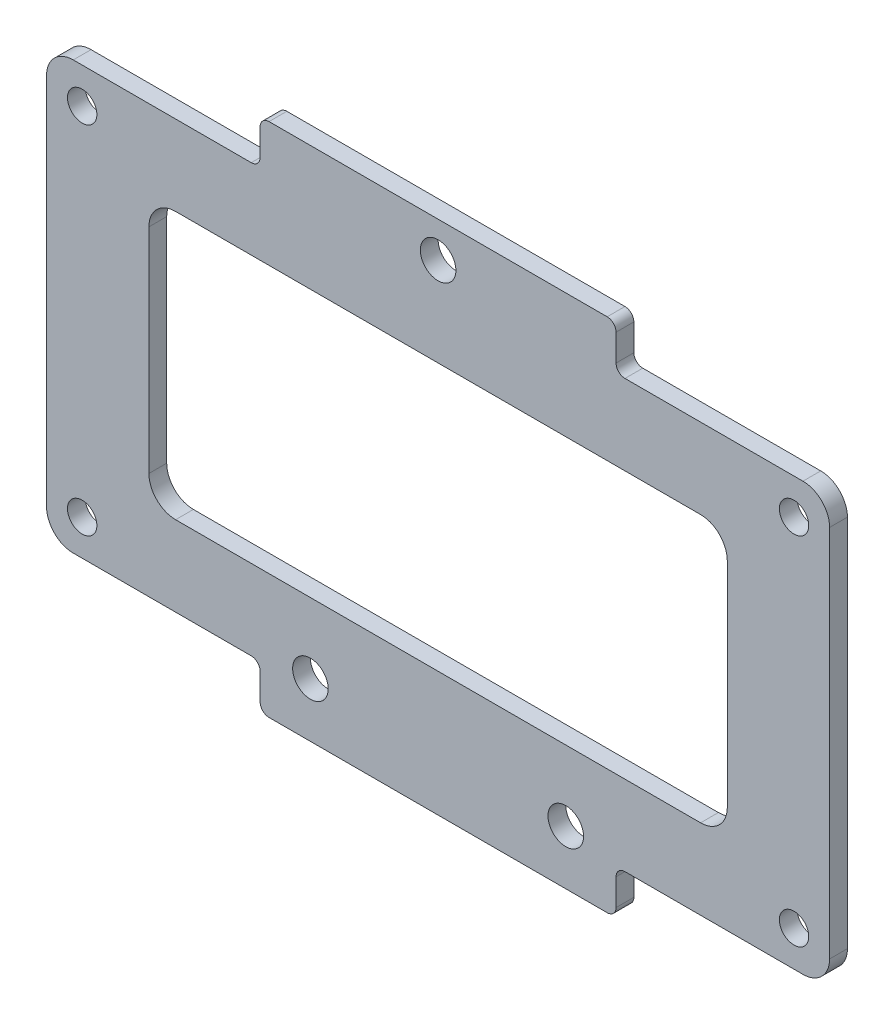
from build123d import *

# Parameters (mm, degrees)
SKETCH_1_W          = 88
SKETCH_1_H          = 48
SKETCH_1_R          = 1.65
EXTRUDE_1_DEPTH     = 2
FILLET_1_R          = 3
SKETCH_3_W          = 40
SKETCH_3_H          = 10
EXTRUDE_2_DEPTH     = 2
SKETCH_2_R          = 2
CUT_EXTRUDE_1_DEPTH = 2
SKETCH_4_W          = 65
SKETCH_4_H          = 30
CUT_EXTRUDE_2_DEPTH = 2
FILLET_2_R          = 3
FILLET_3_R          = 1


with BuildPart() as part:
    # 草图1 → 凸台-拉伸1 (new body)
    with BuildSketch(Plane.XY):
        Rectangle(SKETCH_1_W, SKETCH_1_H)
        with Locations((-40, 20)):
            Circle(SKETCH_1_R, mode=Mode.SUBTRACT)
        with Locations((40, 20)):
            Circle(SKETCH_1_R, mode=Mode.SUBTRACT)
        with Locations((40, -20)):
            Circle(SKETCH_1_R, mode=Mode.SUBTRACT)
        with Locations((-40, -20)):
            Circle(SKETCH_1_R, mode=Mode.SUBTRACT)
    extrude(amount=EXTRUDE_1_DEPTH)

    # 圆角1
    fillet_1_edges = [part.edges().sort_by_distance(p)[0] for p in [
        (-44, 24, 1),
        (44, 24, 1),
        (44, -24, 1),
        (-44, -24, 1),
    ]]
    fillet(fillet_1_edges, radius=FILLET_1_R)

    # 草图3 → 凸台-拉伸2 (add)
    with BuildSketch(Plane.XY.offset(2)):
        with Locations((0, 24)):
            Rectangle(SKETCH_3_W, SKETCH_3_H)
        with Locations((0, -24)):
            Rectangle(SKETCH_3_W, SKETCH_3_H)
    extrude(amount=-EXTRUDE_2_DEPTH)

    # 草图2 → 切除-拉伸1 (cut)
    with BuildSketch(Plane.XY.offset(2)):
        with Locations((0, 25)):
            Circle(SKETCH_2_R)
        with Locations((-14.35, -22.896529102)):
            Circle(SKETCH_2_R)
        with Locations((14.35, -22.896529102)):
            Circle(SKETCH_2_R)
    extrude(amount=-CUT_EXTRUDE_1_DEPTH, mode=Mode.SUBTRACT)

    # 草图4 → 切除-拉伸2 (cut)
    with BuildSketch(Plane.XY.offset(2)):
        Rectangle(SKETCH_4_W, SKETCH_4_H)
    extrude(amount=-CUT_EXTRUDE_2_DEPTH, mode=Mode.SUBTRACT)

    # 圆角2
    fillet_2_edges = [part.edges().sort_by_distance(p)[0] for p in [
        (-32.5, -15, 1),
        (-32.5, 15, 1),
        (32.5, 15, 1),
        (32.5, -15, 1),
    ]]
    fillet(fillet_2_edges, radius=FILLET_2_R)

    # 圆角3
    fillet_3_edges = [part.edges().sort_by_distance(p)[0] for p in [
        (20, 24, 1),
        (-20, 24, 1),
        (20, 29, 1),
        (-20, 29, 1),
        (20, -24, 1),
        (-20, -24, 1),
        (-20, -29, 1),
        (20, -29, 1),
    ]]
    fillet(fillet_3_edges, radius=FILLET_3_R)


solid = part.part
